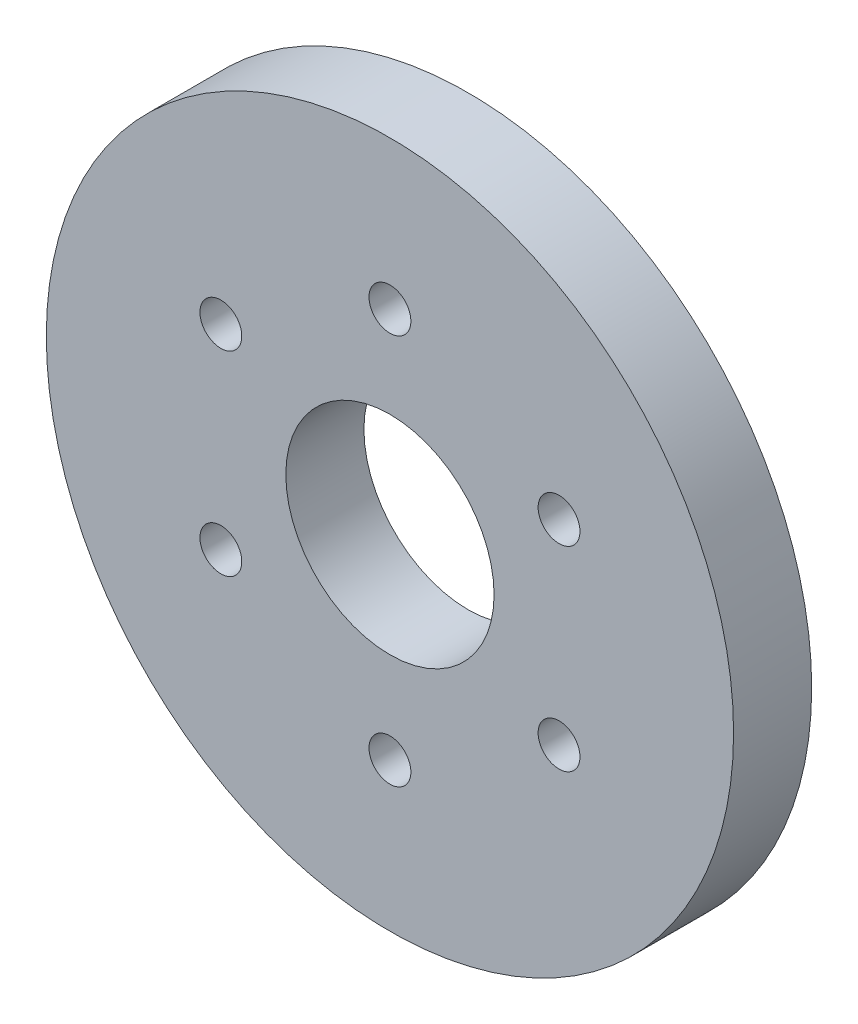
from build123d import *

# Parameters (mm, degrees)
SKETCH1_R           = 41.91
SKETCH1_R_2         = 2.5527
SKETCH1_R_3         = 12.7
BOSS_EXTRUDE1_DEPTH = 9.525


with BuildPart() as part:
    # Sketch1 → Boss-Extrude1 (new body)
    with BuildSketch(Plane.XY):
        with Locations(Location((0, 0, 0), (0, 0, 180))):
            Circle(SKETCH1_R)
        with Locations(Location((0, 23.8125, 0), (0, 0, 180))):
            Circle(SKETCH1_R_2, mode=Mode.SUBTRACT)
        with Locations(Location((20.622229928, 11.90625, 0), (0, 0, 180))):
            Circle(SKETCH1_R_2, mode=Mode.SUBTRACT)
        with Locations(Location((20.622229928, -11.90625, 0), (0, 0, 180))):
            Circle(SKETCH1_R_2, mode=Mode.SUBTRACT)
        with Locations(Location((0, -23.8125, 0), (0, 0, 180))):
            Circle(SKETCH1_R_2, mode=Mode.SUBTRACT)
        with Locations(Location((-20.622229928, -11.90625, 0), (0, 0, 180))):
            Circle(SKETCH1_R_2, mode=Mode.SUBTRACT)
        with Locations(Location((-20.622229928, 11.90625, 0), (0, 0, 180))):
            Circle(SKETCH1_R_2, mode=Mode.SUBTRACT)
        with Locations(Location((0, 0, 0), (0, 0, 180))):
            Circle(SKETCH1_R_3, mode=Mode.SUBTRACT)
    extrude(amount=BOSS_EXTRUDE1_DEPTH)


solid = part.part
